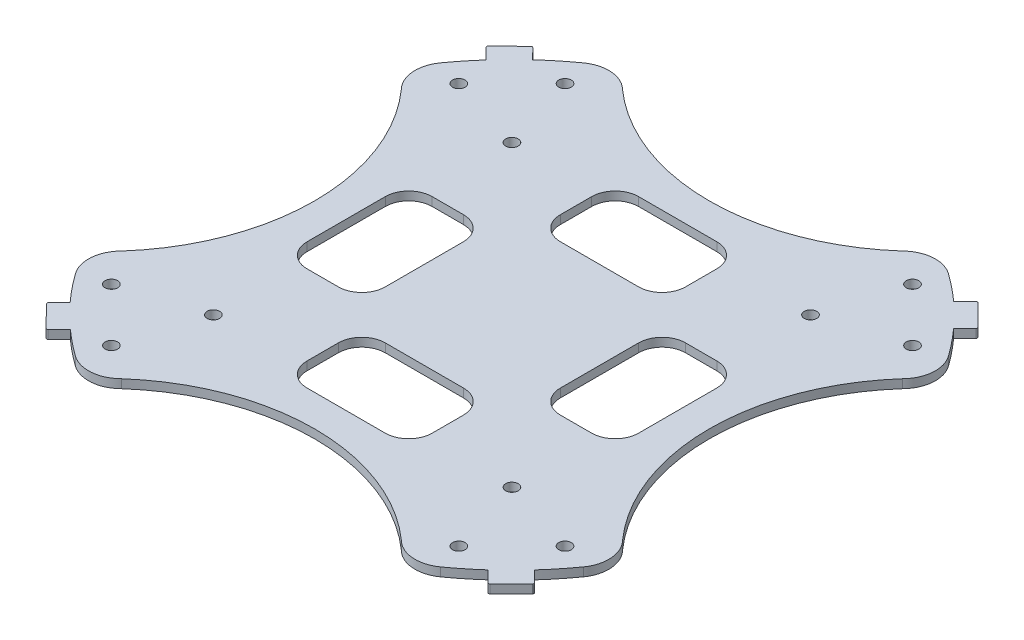
from build123d import *

# Parameters (mm, degrees)
SKETCH1_R           = 1.015999997
SKETCH1_R_2         = 1.015999998
BOSS_EXTRUDE1_DEPTH = 1.397
CUT_EXTRUDE1_DEPTH  = 1.397
BOSS_EXTRUDE2_START = 0.01
BOSS_EXTRUDE2_DEPTH = 0.01


with BuildPart() as part:
    # Sketch1 → Boss-Extrude1 (new body)
    with BuildSketch(Plane(origin=(0, 0, 0), x_dir=(1, 0, 0), z_dir=(0, 1, 0))):
        with BuildLine():
            Line((39.582900137, 36.114993353), (36.135807663, 39.558338119))
            ThreePointArc((36.135807663, 39.558338119), (35.957741585, 39.627761729), (35.781684056, 39.553391627))
            Line((35.781684056, 39.553391627), (33.985632879, 37.75734045))
            ThreePointArc((33.985632879, 37.75734045), (31.864995739, 39.563392759), (29.648553616, 41.25049416))
            ThreePointArc((29.648553616, 41.25049416), (26.08463695, 42.240855836), (22.7274362, 40.687948442))
            ThreePointArc((22.7274362, 40.687948442), (0, 32.054645119), (-22.7274362, 40.687948442))
            ThreePointArc((-22.7274362, 40.687948442), (-26.08463695, 42.240855836), (-29.648553616, 41.25049416))
            ThreePointArc((-29.648553616, 41.25049416), (-31.979190339, 39.471146237), (-34.203281642, 37.560291864))
            Line((-34.203281642, 37.560291864), (-35.891842785, 39.288069847))
            ThreePointArc((-35.891842785, 39.288069847), (-36.070582137, 39.364521411), (-36.251029365, 39.292193022))
            Line((-36.251029365, 39.292193022), (-39.722106603, 35.899901777))
            ThreePointArc((-39.722106603, 35.899901777), (-39.798570717, 35.719704686), (-39.724180022, 35.538641777))
            Line((-39.724180022, 35.538641777), (-37.952779126, 33.76724088))
            ThreePointArc((-37.952779126, 33.76724088), (-39.65514495, 31.750739818), (-41.25049416, 29.648553616))
            ThreePointArc((-41.25049416, 29.648553616), (-42.240855836, 26.08463695), (-40.687948442, 22.7274362))
            ThreePointArc((-40.687948442, 22.7274362), (-32.054645119, 0), (-40.687948442, -22.7274362))
            ThreePointArc((-40.687948442, -22.7274362), (-42.240855836, -26.08463695), (-41.25049416, -29.648553616))
            ThreePointArc((-41.25049416, -29.648553616), (-39.491481287, -31.954074947), (-37.603777167, -34.155467245))
            Line((-37.603777167, -34.155467245), (-39.342333505, -35.894023583))
            ThreePointArc((-39.342333505, -35.894023583), (-39.416724199, -36.072170919), (-39.34438326, -36.251160408))
            Line((-39.34438326, -36.251160408), (-35.996846779, -39.67644344))
            ThreePointArc((-35.996846779, -39.67644344), (-35.8116648, -39.777312417), (-35.614113895, -39.703552292))
            Line((-35.614113895, -39.703552292), (-33.818062671, -37.907501068))
            ThreePointArc((-33.818062671, -37.907501068), (-31.777299231, -39.633864984), (-29.648553616, -41.25049416))
            ThreePointArc((-29.648553616, -41.25049416), (-26.08463695, -42.240855836), (-22.7274362, -40.687948442))
            ThreePointArc((-22.7274362, -40.687948442), (0, -32.054645119), (22.7274362, -40.687948442))
            ThreePointArc((22.7274362, -40.687948442), (26.08463695, -42.240855836), (29.648553616, -41.25049416))
            ThreePointArc((29.648553616, -41.25049416), (31.839816037, -39.583659694), (33.937557164, -37.800558378))
            Line((33.937557164, -37.800558378), (35.712874192, -39.617107153))
            ThreePointArc((35.712874192, -39.617107153), (35.89865706, -39.693541904), (36.081857691, -39.611109667))
            Line((36.081857691, -39.611109667), (39.53818925, -36.154778109))
            ThreePointArc((39.53818925, -36.154778109), (39.581113192, -35.9880354), (39.507835585, -35.832227866))
            Line((39.507835585, -35.832227866), (37.71178436, -34.036176641))
            ThreePointArc((37.71178436, -34.036176641), (39.542043021, -31.891485286), (41.25049416, -29.648553616))
            ThreePointArc((41.25049416, -29.648553616), (42.240855836, -26.08463695), (40.687948442, -22.7274362))
            ThreePointArc((40.687948442, -22.7274362), (32.054645119, 0), (40.687948442, 22.7274362))
            ThreePointArc((40.687948442, 22.7274362), (42.240855836, 26.08463695), (41.25049416, 29.648553616))
            ThreePointArc((41.25049416, 29.648553616), (39.563392759, 31.864995739), (37.75734045, 33.985632879))
            Line((37.75734045, 33.985632879), (39.573889176, 35.76094986))
            ThreePointArc((39.573889176, 35.76094986), (39.650275245, 35.936142133), (39.582900137, 36.114993353))
        make_face()
        with Locations(Location((-28.220170249, 36.841216125, 0), (0, 0, 270))):
            Circle(SKETCH1_R, mode=Mode.SUBTRACT)
        with Locations(Location((-36.841216125, 28.220170249, 0), (0, 0, 90))):
            Circle(SKETCH1_R, mode=Mode.SUBTRACT)
        with Locations(Location((-24.24546392, 24.24546392, 0), (0, 0, 270))):
            Circle(SKETCH1_R_2, mode=Mode.SUBTRACT)
        with Locations(Location((28.220170249, 36.841216125, 0), (0, 0, 90))):
            Circle(SKETCH1_R, mode=Mode.SUBTRACT)
        with Locations(Location((36.841216125, 28.220170249, 0), (0, 0, 270))):
            Circle(SKETCH1_R, mode=Mode.SUBTRACT)
        with Locations(Location((24.24546392, 24.24546392, 0), (0, 0, 270))):
            Circle(SKETCH1_R_2, mode=Mode.SUBTRACT)
        with Locations(Location((36.841216125, -28.220170249, 0), (0, 0, 90))):
            Circle(SKETCH1_R, mode=Mode.SUBTRACT)
        with Locations(Location((28.220170249, -36.841216125, 0), (0, 0, 270))):
            Circle(SKETCH1_R, mode=Mode.SUBTRACT)
        with Locations(Location((24.24546392, -24.24546392, 0), (0, 0, 270))):
            Circle(SKETCH1_R_2, mode=Mode.SUBTRACT)
        with Locations(Location((-28.220170249, -36.841216125, 0), (0, 0, 90))):
            Circle(SKETCH1_R, mode=Mode.SUBTRACT)
        with Locations(Location((-36.841216125, -28.220170249, 0), (0, 0, 270))):
            Circle(SKETCH1_R, mode=Mode.SUBTRACT)
        with Locations(Location((-24.24546392, -24.24546392, 0), (0, 0, 270))):
            Circle(SKETCH1_R_2, mode=Mode.SUBTRACT)
    extrude(amount=BOSS_EXTRUDE1_DEPTH)

    # Sketch3 → Cut-Extrude1 (cut)
    with BuildSketch(Plane(origin=(0, 1.397, 0), x_dir=(1, 0, 0), z_dir=(0, 1, 0))):
        with BuildLine():
            Line((26.924, 6.35), (26.924, -6.35))
            ThreePointArc((26.924, -6.35), (25.808076836, -9.044076836), (23.114, -10.16))
            Line((23.114, -10.16), (18.034, -10.16))
            ThreePointArc((18.034, -10.16), (15.339923164, -9.044076836), (14.224, -6.35))
            Line((14.224, -6.35), (14.224, 6.35))
            ThreePointArc((14.224, 6.35), (15.339923164, 9.044076836), (18.034, 10.16))
            Line((18.034, 10.16), (23.114, 10.16))
            ThreePointArc((23.114, 10.16), (25.808076836, 9.044076836), (26.924, 6.35))
        make_face()
        with BuildLine():
            Line((-6.35, 26.924), (6.35, 26.924))
            ThreePointArc((6.35, 26.924), (9.044076836, 25.808076836), (10.16, 23.114))
            Line((10.16, 23.114), (10.16, 18.034))
            ThreePointArc((10.16, 18.034), (9.044076836, 15.339923164), (6.35, 14.224))
            Line((6.35, 14.224), (-6.35, 14.224))
            ThreePointArc((-6.35, 14.224), (-9.044076836, 15.339923164), (-10.16, 18.034))
            Line((-10.16, 18.034), (-10.16, 23.114))
            ThreePointArc((-10.16, 23.114), (-9.044076836, 25.808076836), (-6.35, 26.924))
        make_face()
        with BuildLine():
            Line((6.35, -26.924), (-6.35, -26.924))
            ThreePointArc((-6.35, -26.924), (-9.044076836, -25.808076836), (-10.16, -23.114))
            Line((-10.16, -23.114), (-10.16, -18.034))
            ThreePointArc((-10.16, -18.034), (-9.044076836, -15.339923164), (-6.35, -14.224))
            Line((-6.35, -14.224), (6.35, -14.224))
            ThreePointArc((6.35, -14.224), (9.044076836, -15.339923164), (10.16, -18.034))
            Line((10.16, -18.034), (10.16, -23.114))
            ThreePointArc((10.16, -23.114), (9.044076836, -25.808076836), (6.35, -26.924))
        make_face()
        with BuildLine():
            Line((-26.924, -6.35), (-26.924, 6.35))
            ThreePointArc((-26.924, 6.35), (-25.808076836, 9.044076836), (-23.114, 10.16))
            Line((-23.114, 10.16), (-18.034, 10.16))
            ThreePointArc((-18.034, 10.16), (-15.339923164, 9.044076836), (-14.224, 6.35))
            Line((-14.224, 6.35), (-14.224, -6.35))
            ThreePointArc((-14.224, -6.35), (-15.339923164, -9.044076836), (-18.034, -10.16))
            Line((-18.034, -10.16), (-23.114, -10.16))
            ThreePointArc((-23.114, -10.16), (-25.808076836, -9.044076836), (-26.924, -6.35))
        make_face()
    extrude(amount=-CUT_EXTRUDE1_DEPTH, mode=Mode.SUBTRACT)

    # Sketch4 → Boss-Extrude2 (add)
    with BuildSketch(Plane.XZ.offset(BOSS_EXTRUDE2_START)):
        with BuildLine():
            Line((33.985632879, -37.75734045), (35.781684056, -39.553391627))
            ThreePointArc((35.781684056, -39.553391627), (35.957741585, -39.627761729), (36.135807663, -39.558338119))
            Line((36.135807663, -39.558338119), (39.582900137, -36.114993353))
            ThreePointArc((39.582900137, -36.114993353), (39.650275245, -35.936142133), (39.573889176, -35.76094986))
            Line((39.573889176, -35.76094986), (37.75734045, -33.985632879))
            ThreePointArc((37.75734045, -33.985632879), (39.563392759, -31.864995739), (41.25049416, -29.648553616))
            ThreePointArc((41.25049416, -29.648553616), (42.240855836, -26.08463695), (40.687948442, -22.7274362))
            ThreePointArc((40.687948442, -22.7274362), (32.054645119, 0), (40.687948442, 22.7274362))
            ThreePointArc((40.687948442, 22.7274362), (42.240855836, 26.08463695), (41.25049416, 29.648553616))
            ThreePointArc((41.25049416, 29.648553616), (39.542043021, 31.891485286), (37.71178436, 34.036176641))
            Line((37.71178436, 34.036176641), (39.507835585, 35.832227866))
            ThreePointArc((39.507835585, 35.832227866), (39.581113192, 35.9880354), (39.53818925, 36.154778109))
            Line((39.53818925, 36.154778109), (36.081857691, 39.611109667))
            ThreePointArc((36.081857691, 39.611109667), (35.89865706, 39.693541904), (35.712874192, 39.617107153))
            Line((35.712874192, 39.617107153), (33.937557164, 37.800558378))
            ThreePointArc((33.937557164, 37.800558378), (31.839816037, 39.583659694), (29.648553616, 41.25049416))
            ThreePointArc((29.648553616, 41.25049416), (26.08463695, 42.240855836), (22.7274362, 40.687948442))
            ThreePointArc((22.7274362, 40.687948442), (0, 32.054645119), (-22.7274362, 40.687948442))
            ThreePointArc((-22.7274362, 40.687948442), (-26.08463695, 42.240855836), (-29.648553616, 41.25049416))
            ThreePointArc((-29.648553616, 41.25049416), (-31.777299231, 39.633864984), (-33.818062671, 37.907501068))
            Line((-33.818062671, 37.907501068), (-35.614113895, 39.703552292))
            ThreePointArc((-35.614113895, 39.703552292), (-35.8116648, 39.777312417), (-35.996846779, 39.67644344))
            Line((-35.996846779, 39.67644344), (-39.34438326, 36.251160408))
            ThreePointArc((-39.34438326, 36.251160408), (-39.416724199, 36.072170919), (-39.342333505, 35.894023583))
            Line((-39.342333505, 35.894023583), (-37.603777167, 34.155467245))
            ThreePointArc((-37.603777167, 34.155467245), (-39.491481287, 31.954074947), (-41.25049416, 29.648553616))
            ThreePointArc((-41.25049416, 29.648553616), (-42.240855836, 26.08463695), (-40.687948442, 22.7274362))
            ThreePointArc((-40.687948442, 22.7274362), (-32.054645119, 0), (-40.687948442, -22.7274362))
            ThreePointArc((-40.687948442, -22.7274362), (-42.240855836, -26.08463695), (-41.25049416, -29.648553616))
            ThreePointArc((-41.25049416, -29.648553616), (-39.65514495, -31.750739818), (-37.952779126, -33.76724088))
            Line((-37.952779126, -33.76724088), (-39.724180022, -35.538641777))
            ThreePointArc((-39.724180022, -35.538641777), (-39.798570717, -35.719704686), (-39.722106603, -35.899901777))
            Line((-39.722106603, -35.899901777), (-36.251029365, -39.292193022))
            ThreePointArc((-36.251029365, -39.292193022), (-36.070582137, -39.364521411), (-35.891842785, -39.288069847))
            Line((-35.891842785, -39.288069847), (-34.203281642, -37.560291864))
            ThreePointArc((-34.203281642, -37.560291864), (-31.979190339, -39.471146237), (-29.648553616, -41.25049416))
            ThreePointArc((-29.648553616, -41.25049416), (-26.08463695, -42.240855836), (-22.7274362, -40.687948442))
            ThreePointArc((-22.7274362, -40.687948442), (0, -32.054645119), (22.7274362, -40.687948442))
            ThreePointArc((22.7274362, -40.687948442), (26.08463695, -42.240855836), (29.648553616, -41.25049416))
            ThreePointArc((29.648553616, -41.25049416), (31.864995739, -39.563392759), (33.985632879, -37.75734045))
        make_face()
        with BuildLine():
            Line((34.031947351, -34.975227797), (35.961893128, -36.905173574))
            Line((35.961893128, -36.905173574), (36.912054688, -35.956045038))
            Line((36.912054688, -35.956045038), (34.959646939, -34.047952742))
            ThreePointArc((34.959646939, -34.047952742), (37.396774434, -31.351575111), (39.626458957, -28.481287726))
            ThreePointArc((39.626458957, -28.481287726), (40.245239062, -26.220934367), (39.236939987, -24.105415731))
            ThreePointArc((39.236939987, -24.105415731), (30.054645119, 0), (39.236939987, 24.105415731))
            ThreePointArc((39.236939987, 24.105415731), (40.245239062, 26.220934367), (39.626458957, 28.481287726))
            ThreePointArc((39.626458957, 28.481287726), (37.382115507, 31.369052268), (34.927801218, 34.080620624))
            Line((34.927801218, 34.080620624), (36.855860414, 36.00867982))
            Line((36.855860414, 36.00867982), (35.908611019, 36.955929215))
            Line((35.908611019, 36.955929215), (34.001651749, 35.004680806))
            ThreePointArc((34.001651749, 35.004680806), (31.326819814, 37.417514086), (28.481287726, 39.626458957))
            ThreePointArc((28.481287726, 39.626458957), (26.220934367, 40.245239062), (24.105415731, 39.236939987))
            ThreePointArc((24.105415731, 39.236939987), (0, 30.054645119), (-24.105415731, 39.236939987))
            ThreePointArc((-24.105415731, 39.236939987), (-26.220934367, 40.245239062), (-28.481287726, 39.626458957))
            ThreePointArc((-28.481287726, 39.626458957), (-31.256819816, 37.476008525), (-33.870544531, 35.131555803))
            Line((-33.870544531, 35.131555803), (-35.777951024, 37.038962296))
            Line((-35.777951024, 37.038962296), (-36.707602479, 36.087719682))
            Line((-36.707602479, 36.087719682), (-34.81536034, 34.195477543))
            ThreePointArc((-34.81536034, 34.195477543), (-37.330404584, 31.430572594), (-39.626458957, 28.481287726))
            ThreePointArc((-39.626458957, 28.481287726), (-40.245239062, 26.220934367), (-39.236939987, 24.105415731))
            ThreePointArc((-39.236939987, 24.105415731), (-30.054645119, 0), (-39.236939987, -24.105415731))
            ThreePointArc((-39.236939987, -24.105415731), (-40.245239062, -26.220934367), (-39.626458957, -28.481287726))
            ThreePointArc((-39.626458957, -28.481287726), (-37.497765548, -31.230715312), (-35.178694145, -33.821583024))
            Line((-35.178694145, -33.821583024), (-37.06110436, -35.703993239))
            Line((-37.06110436, -35.703993239), (-36.101840432, -36.641483938))
            Line((-36.101840432, -36.641483938), (-34.257512326, -34.754321303))
            ThreePointArc((-34.257512326, -34.754321303), (-31.463847338, -37.302363339), (-28.481287726, -39.626458957))
            ThreePointArc((-28.481287726, -39.626458957), (-26.220934367, -40.245239062), (-24.105415731, -39.236939987))
            ThreePointArc((-24.105415731, -39.236939987), (0, -30.054645119), (24.105415731, -39.236939987))
            ThreePointArc((24.105415731, -39.236939987), (26.220934367, -40.245239062), (28.481287726, -39.626458957))
            ThreePointArc((28.481287726, -39.626458957), (31.343015614, -37.403948618), (34.031947351, -34.975227797))
        make_face(mode=Mode.SUBTRACT)
    extrude(amount=-BOSS_EXTRUDE2_DEPTH)


solid = part.part
